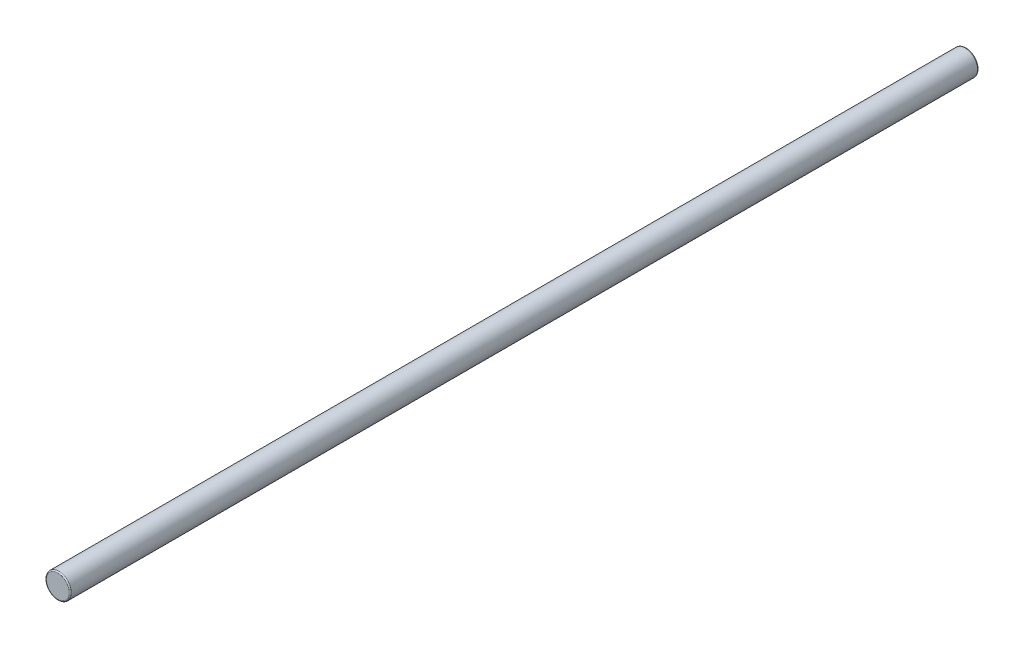
from build123d import *

# Parameters (mm, degrees)
ESBO_O1_R                = 0.55
RESSALTO_EXTRUS_O1_DEPTH = 40
FILETE1_R                = 0.05


with BuildPart() as part:
    # Esboço1 → Ressalto-extrusão1 (new body)
    with BuildSketch(Plane.XY):
        Circle(ESBO_O1_R)
    extrude(amount=RESSALTO_EXTRUS_O1_DEPTH)

    # Filete1
    filete1_edges = [part.edges().sort_by_distance(p)[0] for p in [
        (-0.55, 0, 0),
        (-0.55, 0, 40),
    ]]
    fillet(filete1_edges, radius=FILETE1_R)


solid = part.part
